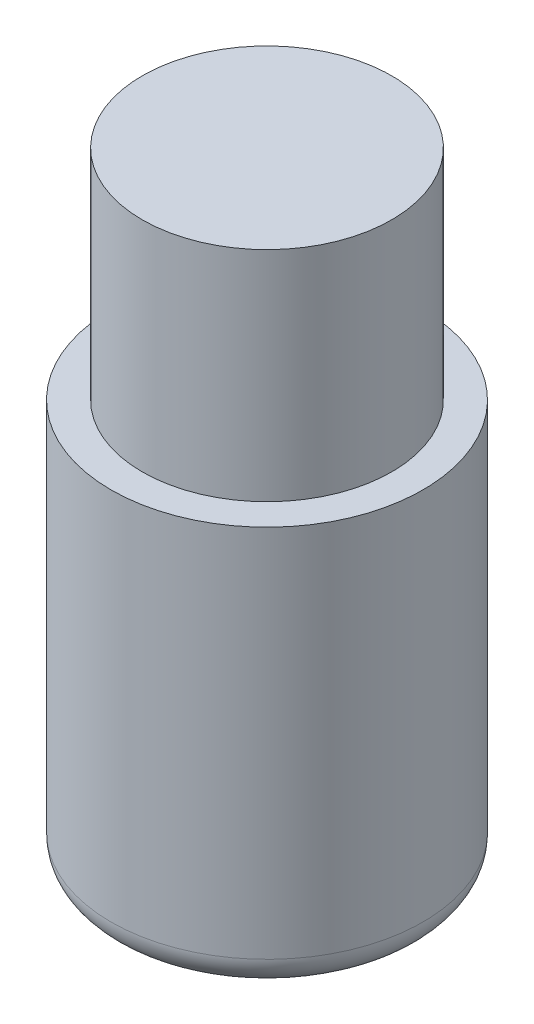
from build123d import *

# Parameters (mm, degrees)
SKETCH1_R           = 5
BOSS_EXTRUDE1_DEPTH = 13
FILLET2_R           = 1
SKETCH2_R           = 4
BOSS_EXTRUDE2_DEPTH = 7


with BuildPart() as part:
    # Sketch1 → Boss-Extrude1 (new body)
    with BuildSketch(Plane(origin=(0, 0, 0), x_dir=(1, 0, 0), z_dir=(0, 1, 0))):
        with Locations(Location((0, 0, 0), (0, 0, 90))):
            Circle(SKETCH1_R)
    extrude(amount=BOSS_EXTRUDE1_DEPTH)

    # Fillet2
    fillet2_edges = [part.edges().sort_by_distance(p)[0] for p in [
        (0, 0, 5),
    ]]
    fillet(fillet2_edges, radius=FILLET2_R)

    # Sketch2 → Boss-Extrude2 (add)
    with BuildSketch(Plane(origin=(0, 13, 0), x_dir=(1, 0, 0), z_dir=(0, 1, 0))):
        with Locations(Location((0, 0, 0), (0, 0, 270))):
            Circle(SKETCH2_R)
    extrude(amount=BOSS_EXTRUDE2_DEPTH)


solid = part.part
